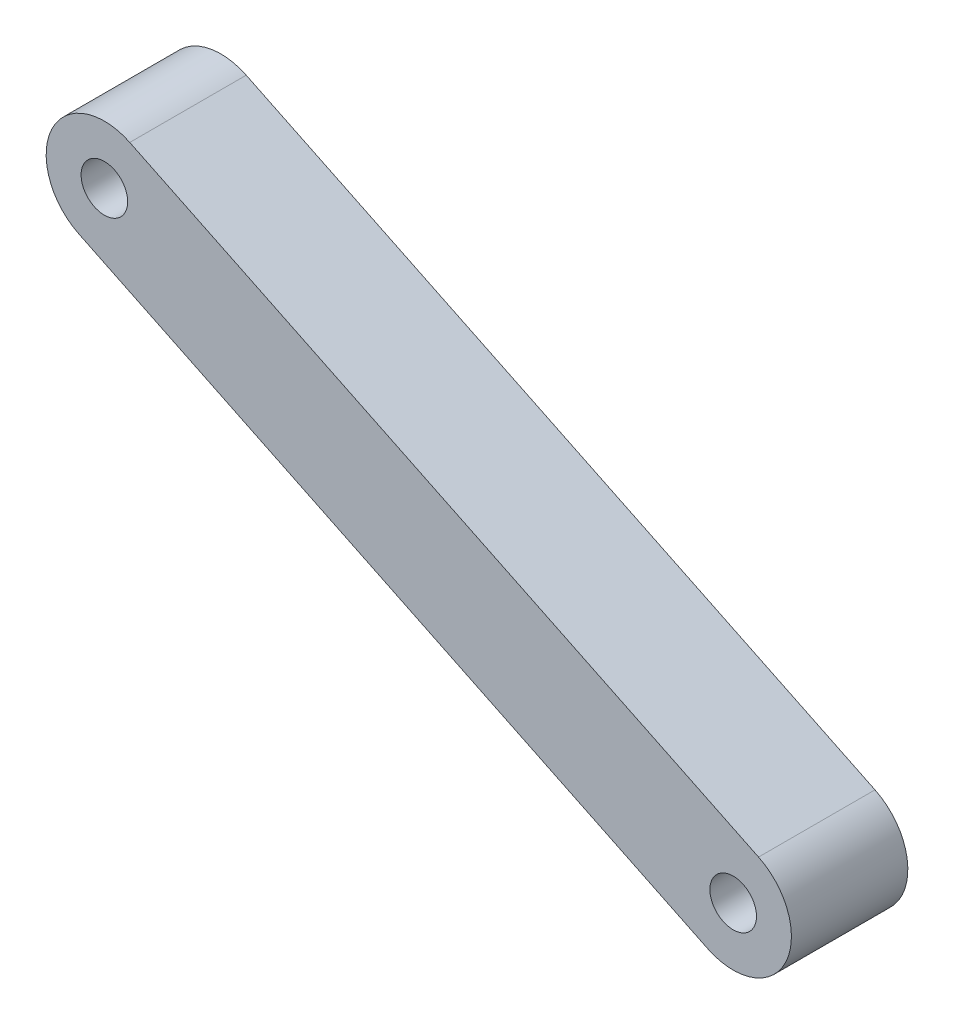
from build123d import *

# Parameters (mm, degrees)
SKETCH1_R           = 2
BOSS_EXTRUDE1_DEPTH = 10


with BuildPart() as part:
    # Sketch1 → Boss-Extrude1 (new body)
    with BuildSketch(Plane.XY):
        with BuildLine():
            Line((-61.313532658, 11.252747212), (-7.312045472, -14.897575572))
            ThreePointArc((-7.312045472, -14.897575572), (-0.632727975, -12.576645205), (-2.953658341, -5.897327707))
            Line((-2.953658341, -5.897327707), (-56.955145527, 20.252995077))
            ThreePointArc((-56.955145527, 20.252995077), (-63.634463025, 17.93206471), (-61.313532658, 11.252747212))
        make_face()
        with Locations((-59.134339093, 15.752871145)):
            Circle(SKETCH1_R, mode=Mode.SUBTRACT)
        with Locations((-5.132851907, -10.397451639)):
            Circle(SKETCH1_R, mode=Mode.SUBTRACT)
    extrude(amount=BOSS_EXTRUDE1_DEPTH)


solid = part.part
